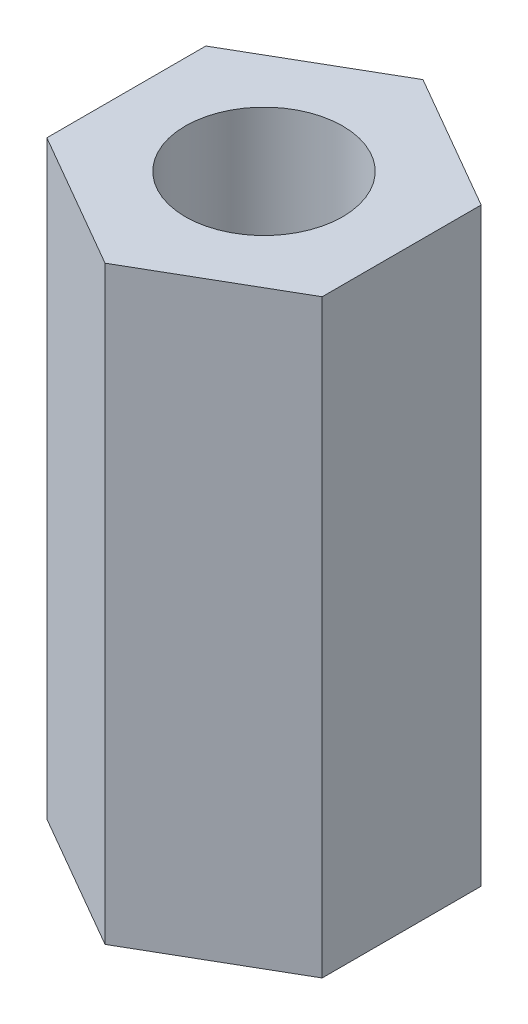
from build123d import *

# Parameters (mm, degrees)
SKETCH1_R           = 2
BOSS_EXTRUDE1_DEPTH = 15


with BuildPart() as part:
    # Sketch1 → Boss-Extrude1 (new body)
    with BuildSketch(Plane(origin=(0, 0, 0), x_dir=(1, 0, 0), z_dir=(0, 1, 0))):
        Polygon((3.5, 2.020725942), (0, 4.041451884), (-3.5, 2.020725942), (-3.5, -2.020725942), (0, -4.041451884), (3.5, -2.020725942), align=None)
        with Locations(Location((0, 0, 0), (0, 0, 270))):
            Circle(SKETCH1_R, mode=Mode.SUBTRACT)
    extrude(amount=BOSS_EXTRUDE1_DEPTH)


solid = part.part
